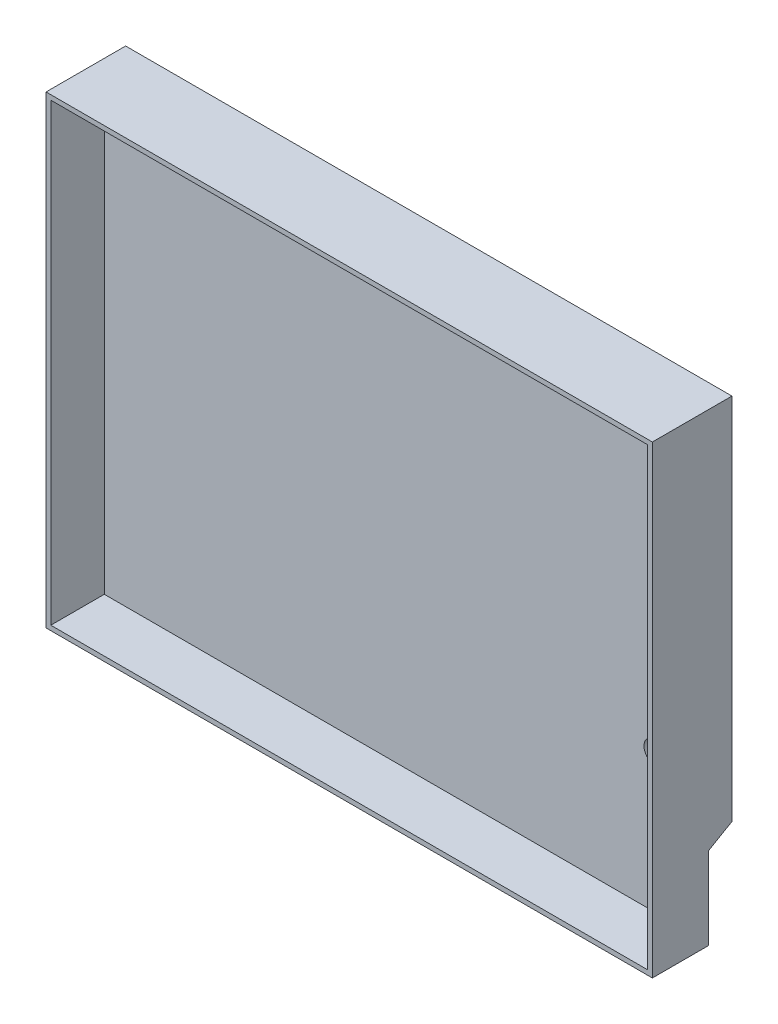
from build123d import *

# Parameters (mm, degrees)
CROQUIS1_W              = 128
CROQUIS1_H              = 98
SALIENTE_EXTRUIR1_DEPTH = 11.8
CROQUIS2_W              = 126
CROQUIS2_H              = 96
CORTAR_EXTRUIR1_DEPTH   = 11.3
SALIENTE_EXTRUIR2_DEPTH = 128
CROQUIS7_R              = 2.5
CORTAR_EXTRUIR2_DEPTH   = 22


with BuildPart() as part:
    # Croquis1 → Saliente-Extruir1 (new body)
    with BuildSketch(Plane.XY):
        with Locations((-9.684466696, -19.00455338)):
            Rectangle(CROQUIS1_W, CROQUIS1_H)
    extrude(amount=SALIENTE_EXTRUIR1_DEPTH)

    # Croquis2 → Cortar-Extruir1 (cut)
    with BuildSketch(Plane.XY.offset(11.8)):
        with Locations((-9.684466696, -19.00455338)):
            Rectangle(CROQUIS2_W, CROQUIS2_H)
    extrude(amount=-CORTAR_EXTRUIR1_DEPTH, mode=Mode.SUBTRACT)

    # Croquis5 → Saliente-Extruir2 (add)
    with BuildSketch(Plane.ZY.offset(73.684466696)):
        Polygon((0, -50.68455338), (-4.99696658, -47.79955338), (-4.99696658, 29.99544662), (0, 29.99544662), align=None)
    extrude(amount=-SALIENTE_EXTRUIR2_DEPTH)

    # Croquis7 → Cortar-Extruir2 (cut)
    with BuildSketch(Plane(origin=(0, 0, -4.99696658), x_dir=(-1, 0, 0), z_dir=(0, 0, -1))):
        with Locations(Location((-43.751056656, -37.767924802, 0), (0, 0, 90))):
            Circle(CROQUIS7_R)
    extrude(amount=-CORTAR_EXTRUIR2_DEPTH, mode=Mode.SUBTRACT)


solid = part.part
